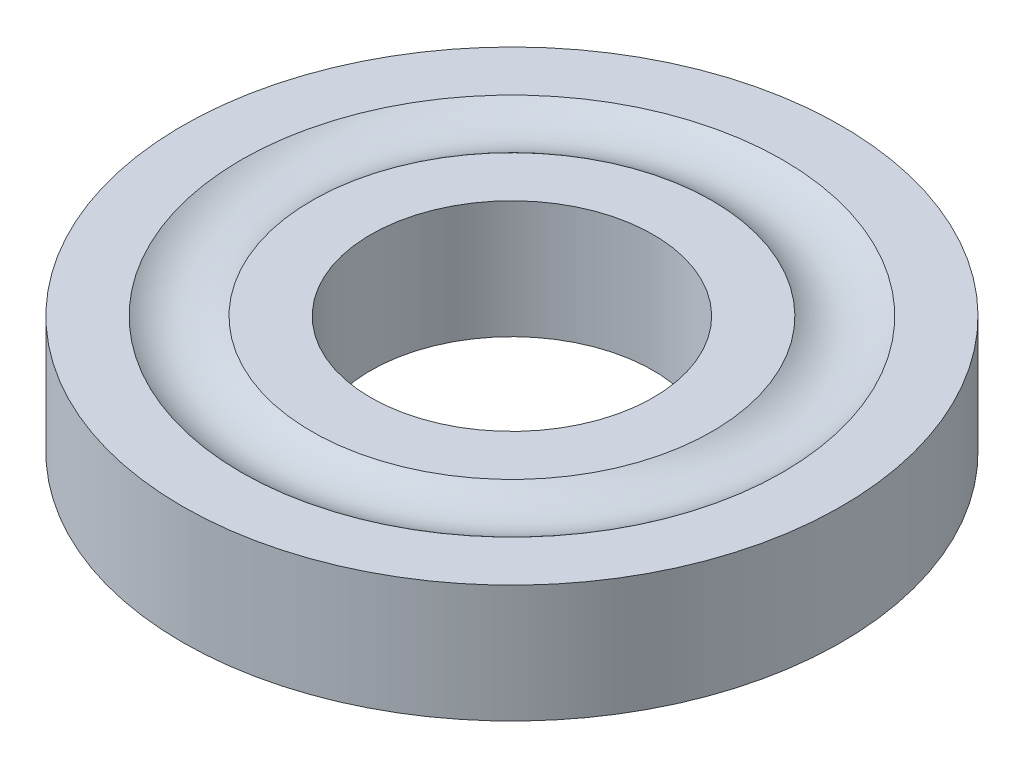
from build123d import *

# Parameters (mm, degrees)
SKETCH1_R           = 3.5
SKETCH1_R_2         = 1.5
BOSS_EXTRUDE1_DEPTH = 1.25
SKETCH2_R           = 0.625


with BuildPart() as part:
    # Sketch1 → Boss-Extrude1 (new body)
    with BuildSketch(Plane(origin=(0, 0, 0), x_dir=(1, 0, 0), z_dir=(0, 1, 0))):
        with Locations(Location((0, 0, 0), (0, 0, 270))):
            Circle(SKETCH1_R)
        with Locations(Location((0, 0, 0), (0, 0, 270))):
            Circle(SKETCH1_R_2, mode=Mode.SUBTRACT)
    extrude(amount=BOSS_EXTRUDE1_DEPTH)

    # Sketch2 → Cut-Revolve1 (revolve, cut)
    with BuildSketch(Plane.XY, mode=Mode.PRIVATE) as cut_revolve1_sk:
        with Locations((-2.5, 1.75)):
            Circle(SKETCH2_R)
    revolve(cut_revolve1_sk.sketch.rotate(Axis((0, 0, 0), (0, 1, 0)), 270), axis=Axis((0, 0, 0), (0, 1, 0)), mode=Mode.SUBTRACT)


solid = part.part
